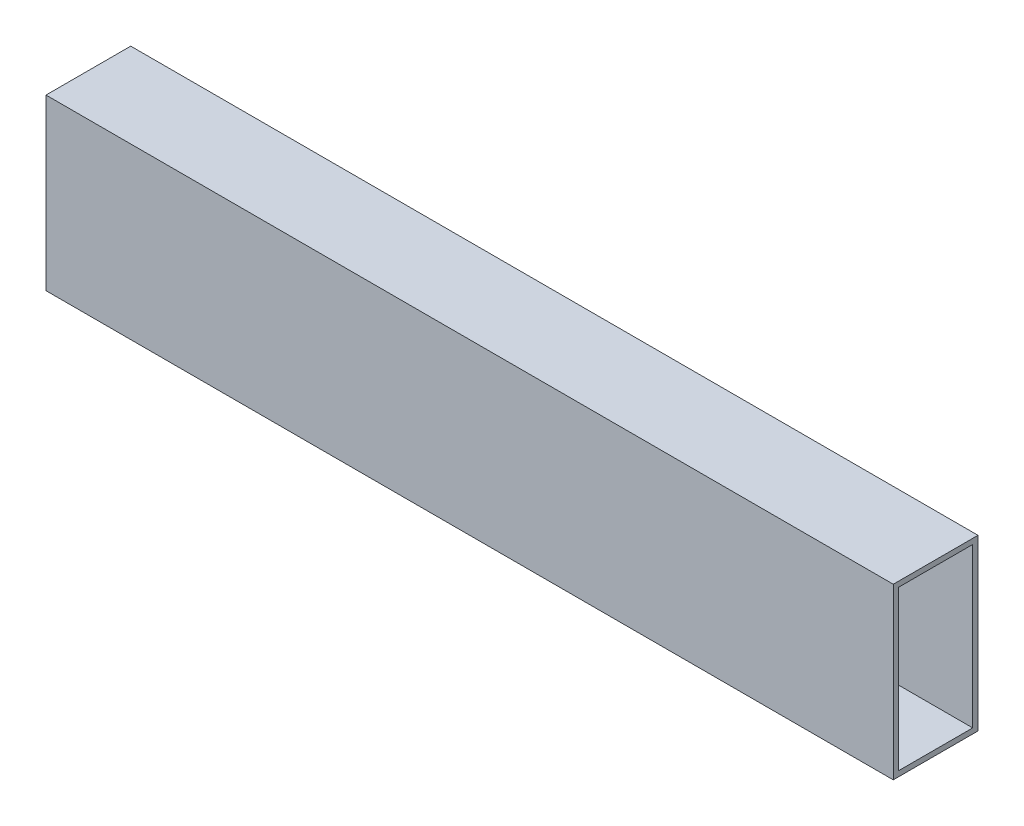
from build123d import *

# Parameters (mm, degrees)
SKETCH1_W           = 25.4
SKETCH1_H           = 50.8
SKETCH1_W_2         = 22.225
SKETCH1_H_2         = 47.625
BOSS_EXTRUDE1_DEPTH = 127


with BuildPart() as part:
    # Sketch1 → Boss-Extrude1 (new, symmetric)
    with BuildSketch(Plane(origin=(0, 0, 0), x_dir=(0, 0, -1), z_dir=(1, 0, 0))):
        with Locations((1.923003206, 0)):
            Rectangle(SKETCH1_W, SKETCH1_H)
        with Locations((1.923003206, 0)):
            Rectangle(SKETCH1_W_2, SKETCH1_H_2, mode=Mode.SUBTRACT)
    extrude(amount=BOSS_EXTRUDE1_DEPTH, both=True)


solid = part.part
